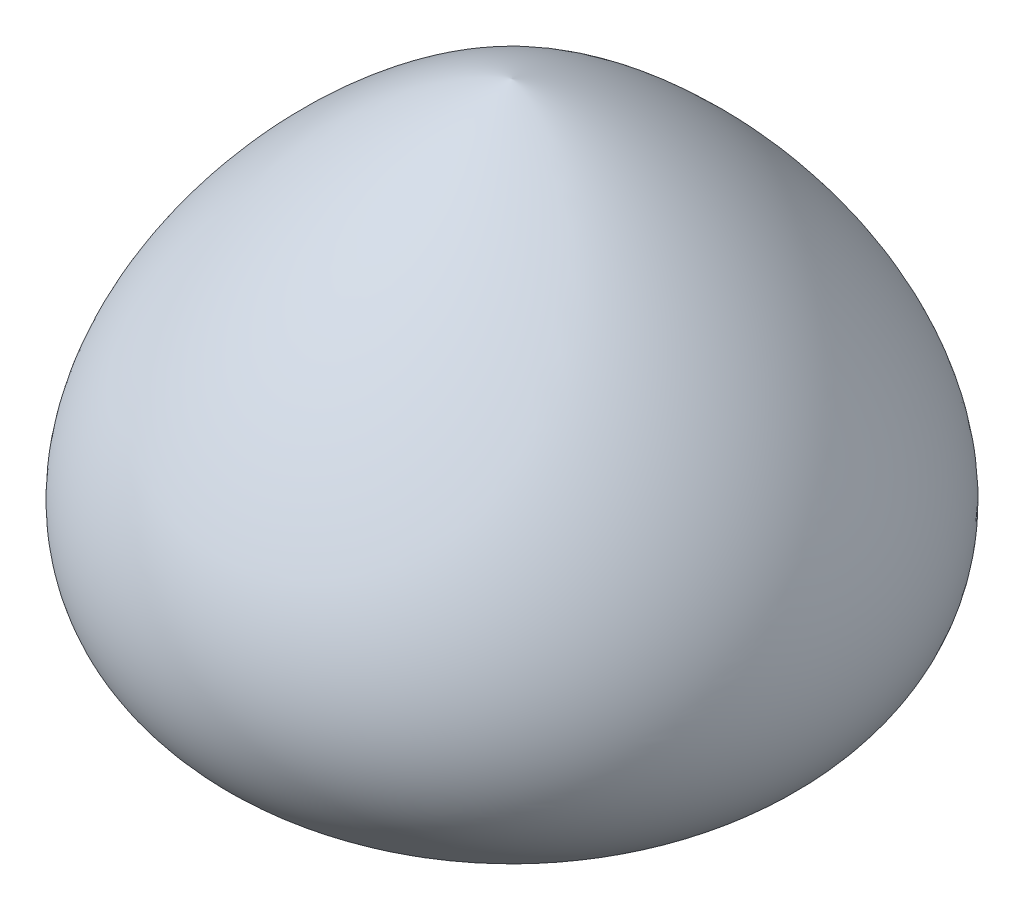
from build123d import *

# Parameters (mm, degrees)
SKETCH7_R           = 1.15
BOSS_EXTRUDE1_DEPTH = 2


with BuildPart() as part:
    # Sketch5 → Revolve2 (revolve)
    with BuildSketch(Plane(origin=(0, 0, 0), x_dir=(0, 0, -1), z_dir=(1, 0, 0))):
        with BuildLine():
            Line((-0.69061973, -0.755110829), (-0.69061973, 9.362756418))
            add(Edge.make_bspline(
                [(-0.69061973, 9.362756418), (3.594345033, 8.256402369), (9.93487322, 0.101606755), (-0.69061973, -0.755110829)],
                knots=[0, 0, 0, 0, 1, 1, 1, 1], degree=3))
        make_face()
    revolve(axis=Axis((0, -0.755110829, 0.69061973), (0, 1, 0)))

    # Sketch7 → Boss-Extrude1 (add)
    with BuildSketch(Plane(origin=(0, 0, 0), x_dir=(1, 0, 0), z_dir=(0, 1, 0))):
        with Locations(Location((0, 0, 0), (0, 0, 270))):
            Circle(SKETCH7_R)
    extrude(amount=-BOSS_EXTRUDE1_DEPTH)


solid = part.part
